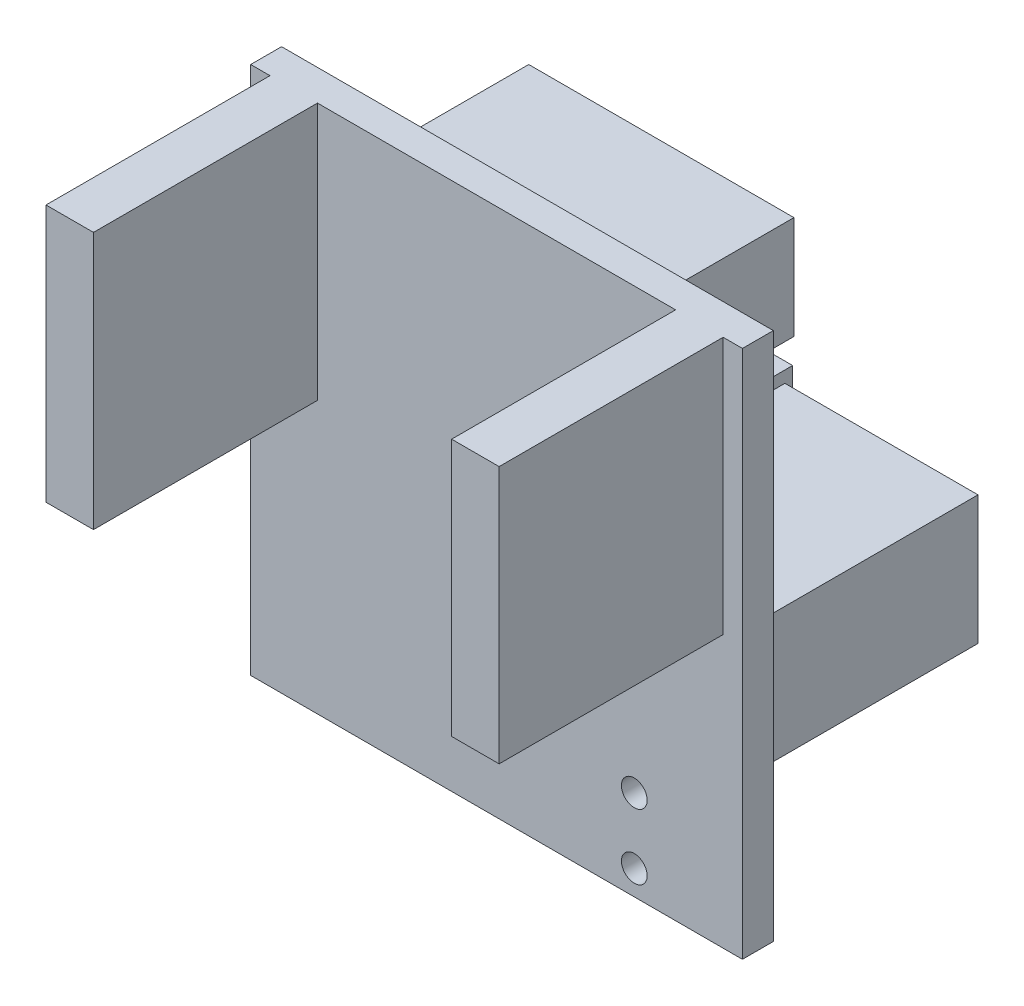
from build123d import *

# Parameters (mm, degrees)
SKETCH_1_W          = 19.1
SKETCH_1_H          = 20.55
EXTRUDE_1_DEPTH     = 1.2
SKETCH_2_W          = 1.844375839
SKETCH_2_H          = 10
EXTRUDE_2_DEPTH     = 8.7
SKETCH_3_W          = 7.5
SKETCH_3_H          = 5
EXTRUDE_3_DEPTH     = 8.7
SKETCH_4_W          = 8
SKETCH_4_H          = 7.55
EXTRUDE_4_DEPTH     = 11
SKETCH_5_W          = 10.3
SKETCH_5_H          = 4
EXTRUDE_5_DEPTH     = 4.5
SKETCH_6_R          = 0.5
CUT_EXTRUDE_1_DEPTH = 18.826332349


with BuildPart() as part:
    # ｽｹｯﾁ1 → ﾎﾞｽ - 押し出し1 (new body)
    with BuildSketch(Plane.XY):
        Rectangle(SKETCH_1_W, SKETCH_1_H)
    extrude(amount=EXTRUDE_1_DEPTH)

    # ｽｹｯﾁ2 → ﾎﾞｽ - 押し出し2 (add)
    with BuildSketch(Plane.XY.offset(1.2)):
        with Locations((7.877812081, 5.275)):
            Rectangle(SKETCH_2_W, SKETCH_2_H)
    extrude_2 = extrude(amount=EXTRUDE_2_DEPTH)

    # ﾐﾗｰ1: ﾎﾞｽ - 押し出し2 across plane
    add(extrude_2.mirror(Plane(origin=(0, 0, 0), x_dir=(0, 0, 1), z_dir=(1, 0, 0))))

    # ｽｹｯﾁ3 → ﾎﾞｽ - 押し出し3 (add)
    with BuildSketch(Plane(origin=(0, 0, 0), x_dir=(-1, 0, 0), z_dir=(0, 0, -1))):
        with Locations((-5.05, -2.475)):
            Rectangle(SKETCH_3_W, SKETCH_3_H)
    extrude(amount=EXTRUDE_3_DEPTH)

    # ｽｹｯﾁ4 → ﾎﾞｽ - 押し出し4 (add)
    with BuildSketch(Plane(origin=(0, 0, 0), x_dir=(-1, 0, 0), z_dir=(0, 0, -1))):
        with Locations((4.7, -5.3)):
            Rectangle(SKETCH_4_W, SKETCH_4_H)
    extrude(amount=EXTRUDE_4_DEPTH)

    # ｽｹｯﾁ5 → ﾎﾞｽ - 押し出し5 (add)
    with BuildSketch(Plane(origin=(0, 0, 0), x_dir=(-1, 0, 0), z_dir=(0, 0, -1))):
        with Locations((-0.7, 7.975)):
            Rectangle(SKETCH_5_W, SKETCH_5_H)
    extrude(amount=EXTRUDE_5_DEPTH)

    # ｽｹｯﾁ6 → ｶｯﾄ - 押し出し1 (cut, through all)
    with BuildSketch(Plane(origin=(0, 0, 0), x_dir=(-1, 0, 0), z_dir=(0, 0, -1))):
        with Locations((-5.35, -6.775)):
            Circle(SKETCH_6_R)
        with Locations((-5.35, -9.315)):
            Circle(SKETCH_6_R)
    extrude(amount=-CUT_EXTRUDE_1_DEPTH, mode=Mode.SUBTRACT)


solid = part.part
